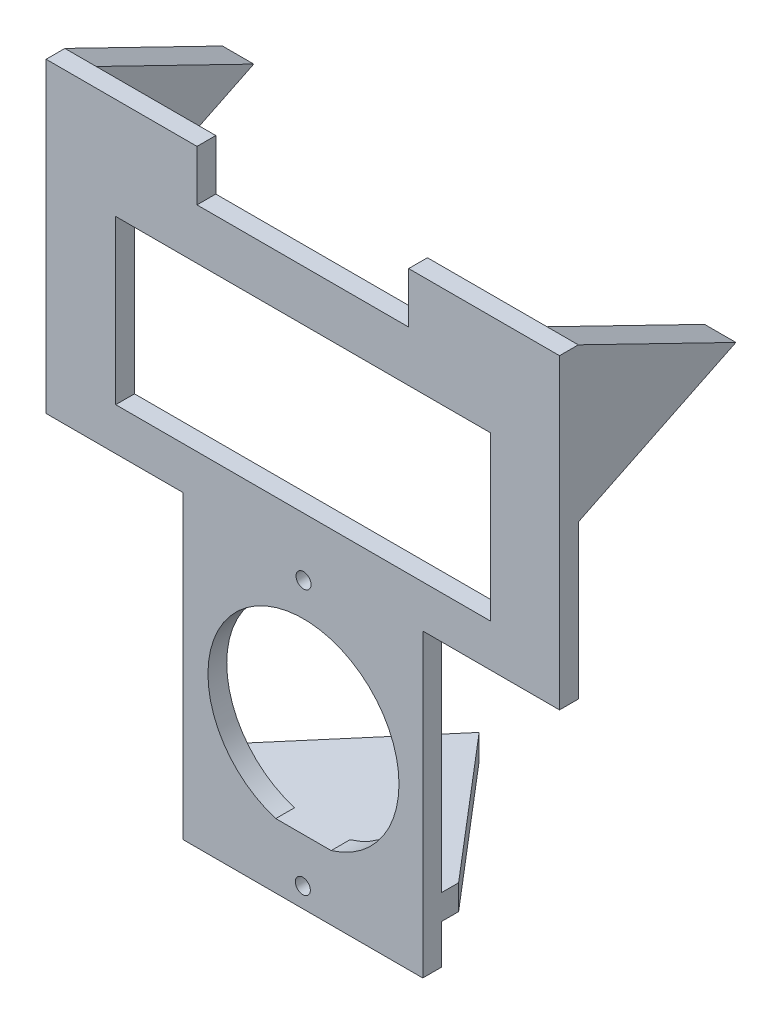
from build123d import *

# Parameters (mm, degrees)
ESQUISSE1_W             = 82
ESQUISSE1_H             = 49
BOSS_EXTRU_1_DEPTH      = 3
ESQUISSE2_W             = 38.309373872
ESQUISSE2_H             = 3
BOSS_EXTRU_2_DEPTH      = 48
ESQUISSE3_R             = 15.255971645
ENL_V_MAT_EXTRU_1_DEPTH = 96.571962416
ESQUISSE4_W             = 33.801324292
ESQUISSE4_H             = 8.092552901
ENL_V_MAT_EXTRU_2_DEPTH = 96.571962416
BOSS_EXTRU_3_DEPTH      = 5
BOSS_EXTRU_4_DEPTH      = 5
ESQUISSE8_R             = 1.2
ENL_V_MAT_EXTRU_3_DEPTH = 99.784235864
BOSS_EXTRU_6_START      = -38.309374
ESQUISSE9_W             = 5.724168344
ESQUISSE9_H             = 4
BOSS_EXTRU_6_DEPTH      = 38.309374
BOSS_EXTRU_7_DEPTH      = 4
ESQUISSE11_R            = 1.2
ENL_V_MAT_EXTRU_4_DEPTH = 99.784235864
ESQUISSE12_W            = 59.88479499
ESQUISSE12_H            = 26.036139414
ENL_V_MAT_EXTRU_5_DEPTH = 100.590767548


with BuildPart() as part:
    # Esquisse1 → Boss.-Extru.1 (new body)
    with BuildSketch(Plane.XY):
        with Locations((41, 24.5)):
            Rectangle(ESQUISSE1_W, ESQUISSE1_H)
    extrude(amount=BOSS_EXTRU_1_DEPTH)

    # Esquisse2 → Boss.-Extru.2 (add)
    with BuildSketch(Plane.XZ):
        with Locations((41, 1.5)):
            Rectangle(ESQUISSE2_W, ESQUISSE2_H)
    extrude(amount=BOSS_EXTRU_2_DEPTH)

    # Esquisse3 → Enlèv. mat.-Extru.1 (cut, through all)
    with BuildSketch(Plane(origin=(0, 0, 0), x_dir=(-1, 0, 0), z_dir=(0, 0, -1))):
        with Locations((-41.103242704, -23.088178639)):
            Circle(ESQUISSE3_R)
    extrude(amount=-ENL_V_MAT_EXTRU_1_DEPTH, mode=Mode.SUBTRACT)

    # Esquisse4 → Enlèv. mat.-Extru.2 (cut, through all)
    with BuildSketch(Plane(origin=(0, 0, 0), x_dir=(-1, 0, 0), z_dir=(0, 0, -1))):
        with Locations((-41, 44.953723549)):
            Rectangle(ESQUISSE4_W, ESQUISSE4_H)
    extrude(amount=-ENL_V_MAT_EXTRU_2_DEPTH, mode=Mode.SUBTRACT)

    # Esquisse5 → Boss.-Extru.3 (add)
    with BuildSketch(Plane(origin=(82, 0, 0), x_dir=(0, 0, -1), z_dir=(1, 0, 0))):
        Polygon((0, 49), (0, 24.5), (25.165954286, 36.75), align=None)
    extrude(amount=-BOSS_EXTRU_3_DEPTH)

    # Esquisse6 → Boss.-Extru.4 (add)
    with BuildSketch(Plane.ZY):
        Polygon((0, 49), (0, 24.5), (-25.165954286, 36.75), align=None)
    extrude(amount=-BOSS_EXTRU_4_DEPTH)

    # Esquisse8 → Enlèv. mat.-Extru.3 (cut, through all)
    with BuildSketch(Plane(origin=(0, 0, 0), x_dir=(-1, 0, 0), z_dir=(0, 0, -1))):
        with Locations((-41.11564979, -2.509917341)):
            Circle(ESQUISSE8_R)
    extrude(amount=-ENL_V_MAT_EXTRU_3_DEPTH, mode=Mode.SUBTRACT)

    # Esquisse9 → Boss.-Extru.6 (add)
    with BuildSketch(Plane.ZY.offset(-21.845313064).offset(BOSS_EXTRU_6_START)):
        with Locations((0.137915828, -39.687870455)):
            Rectangle(ESQUISSE9_W, ESQUISSE9_H)
    extrude(amount=BOSS_EXTRU_6_DEPTH)

    # Esquisse10 → Boss.-Extru.7 (add)
    with BuildSketch(Plane.XZ.offset(41.687870455)):
        Polygon((21.845313064, -2.724168344), (60.154686936, -2.724168344), (41, -25.159658009), align=None)
    extrude(amount=-BOSS_EXTRU_7_DEPTH)

    # Esquisse11 → Enlèv. mat.-Extru.4 (cut, through all)
    with BuildSketch(Plane(origin=(0, 0, 0), x_dir=(-1, 0, 0), z_dir=(0, 0, -1))):
        with Locations((-41, -44.843935227)):
            Circle(ESQUISSE11_R)
    extrude(amount=-ENL_V_MAT_EXTRU_4_DEPTH, mode=Mode.SUBTRACT)

    # Esquisse12 → Enlèv. mat.-Extru.5 (cut, through all)
    with BuildSketch(Plane.XY.offset(3)):
        with Locations((41.057824895, 19.798764879)):
            Rectangle(ESQUISSE12_W, ESQUISSE12_H)
    extrude(amount=-ENL_V_MAT_EXTRU_5_DEPTH, mode=Mode.SUBTRACT)


solid = part.part
